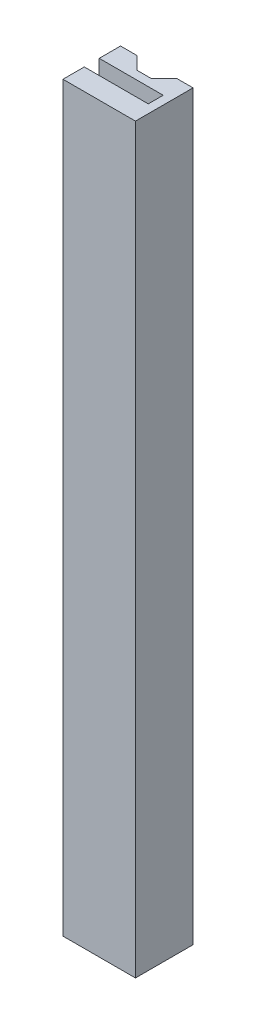
from build123d import *

# Parameters (mm, degrees)
BOSS_EXTRUDE1_DEPTH = 174


with BuildPart() as part:
    # Sketch1 → Boss-Extrude1 (new body)
    with BuildSketch(Plane(origin=(0, 0, 0), x_dir=(1, 0, 0), z_dir=(0, 1, 0))):
        Polygon((-8.498132752, 13.5), (-4.648132752, 13.5), (-1.65, 10.501867248), (1.65, 10.501867248), (4.648132752, 13.5), (8.498132752, 13.5), (8.498132752, 0), (-8.498132752, 0), (-8.498132752, 5), (6.501867248, 5), (6.501867248, 8.5), (-8.498132752, 8.5), align=None)
    extrude(amount=BOSS_EXTRUDE1_DEPTH)


solid = part.part
